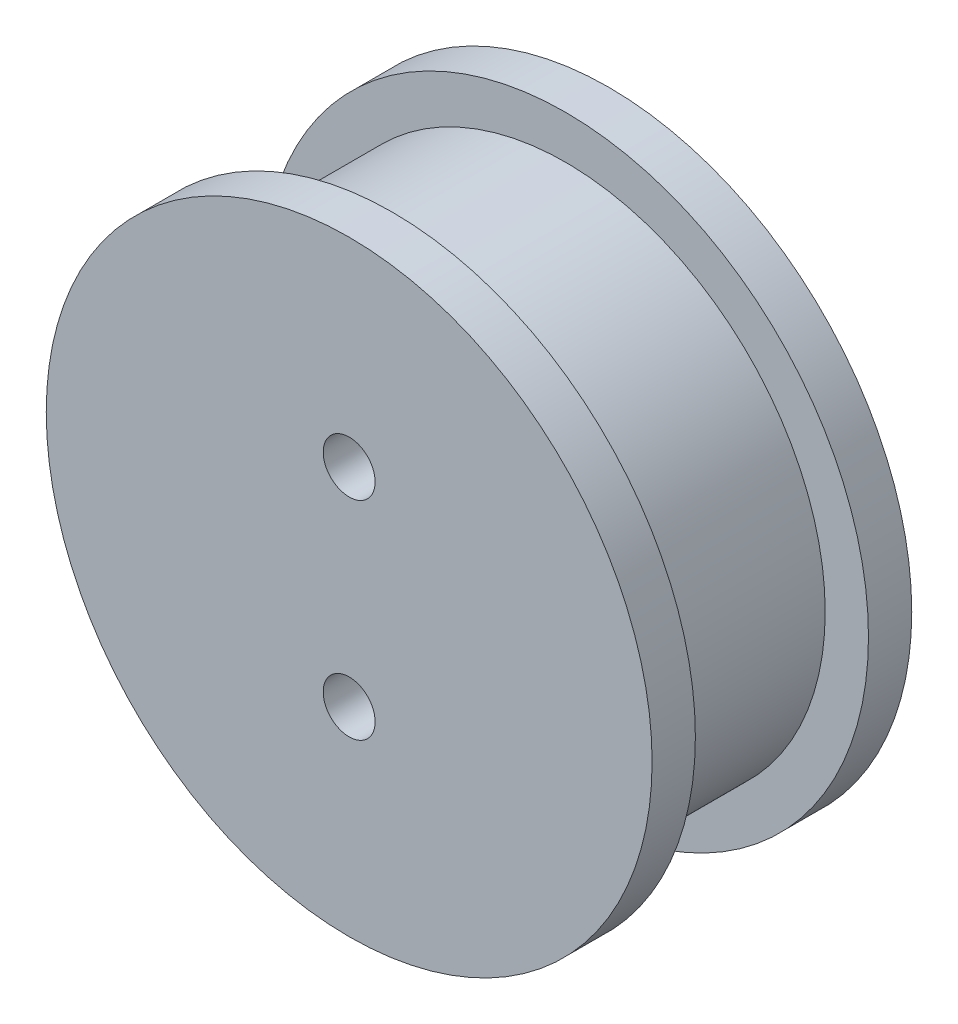
from build123d import *

# Parameters (mm, degrees)
CROQUIS1_R              = 17.5
SALIENTE_EXTRUIR1_DEPTH = 7.5
CROQUIS2_R              = 17.5
CROQUIS2_R_2            = 15
CORTAR_EXTRUIR1_DEPTH   = 5
CROQUIS3_R              = 1.5
CORTAR_EXTRUIR2_DEPTH   = 10


with BuildPart() as part:
    # Croquis1 → Saliente-Extruir1 (new, symmetric)
    with BuildSketch(Plane(origin=(0, 0, 0), x_dir=(0, 1, 0), z_dir=(0, 0, 1))):
        with Locations(Location((0, 0, 0), (0, 0, 270))):
            Circle(CROQUIS1_R)
    extrude(amount=SALIENTE_EXTRUIR1_DEPTH, both=True)

    # Croquis2 → Cortar-Extruir1 (cut, symmetric)
    with BuildSketch(Plane(origin=(0, 0, 0), x_dir=(0, 1, 0), z_dir=(0, 0, 1))):
        with Locations(Location((0, 0, 0), (0, 0, 270))):
            Circle(CROQUIS2_R)
        with Locations(Location((0, 0, 0), (0, 0, 270))):
            Circle(CROQUIS2_R_2, mode=Mode.SUBTRACT)
    extrude(amount=CORTAR_EXTRUIR1_DEPTH, both=True, mode=Mode.SUBTRACT)

    # Croquis3 → Cortar-Extruir2 (cut, symmetric)
    with BuildSketch(Plane(origin=(0, 0, 0), x_dir=(0, 1, 0), z_dir=(0, 0, 1))):
        with Locations(Location((6, 0, 0), (0, 0, 270))):
            Circle(CROQUIS3_R)
        with Locations(Location((-6, 0, 0), (0, 0, 270))):
            Circle(CROQUIS3_R)
    extrude(amount=CORTAR_EXTRUIR2_DEPTH, both=True, mode=Mode.SUBTRACT)


solid = part.part
